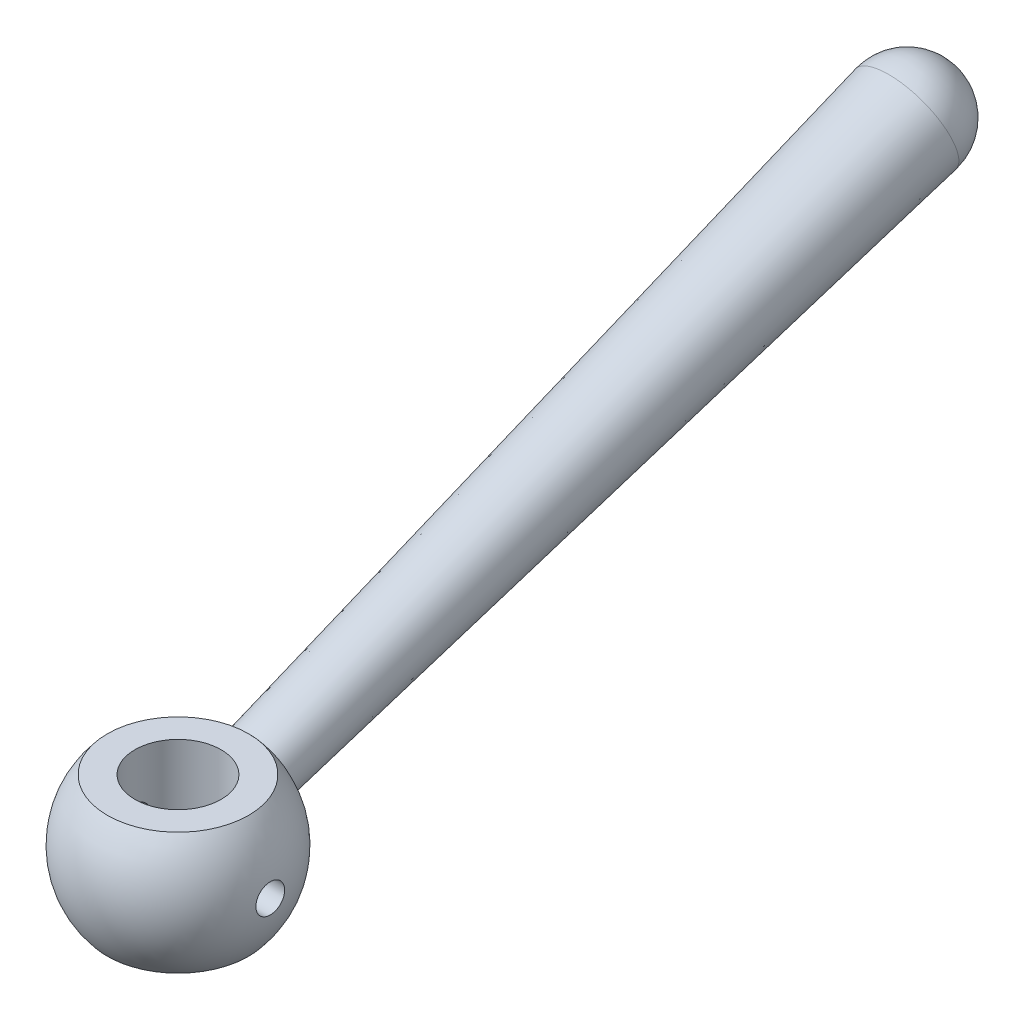
from build123d import *

# Parameters (mm, degrees)
CUT_EXTRUDE_1_DEPTH      = 23.516660498
CUT_EXTRUDE_1_DEPTH_BACK = 23.516660498
SKETCH_2_OUTSIDE_W       = 37.006
SKETCH_2_OUTSIDE_H       = 37.006
SKETCH_2_OUTSIDE_W_2     = 26
SKETCH_2_OUTSIDE_H_2     = 17
CUT_EXTRUDE_2_DEPTH      = 26.039968051
CUT_EXTRUDE_2_DEPTH_BACK = 26.039968051
SKETCH_3_R               = 6
CUT_EXTRUDE_3_DEPTH      = 21.254629101
CUT_EXTRUDE_3_DEPTH_BACK = 21.254629101
SKETCH_4_R               = 2


with BuildPart() as part:
    # 草图1 → 旋转1 (revolve)
    with BuildSketch(Plane(origin=(0, 0, 0), x_dir=(0, 0, -1), z_dir=(1, 0, 0))):
        with BuildLine():
            Line((0, 13), (0, -13))
            ThreePointArc((0, -13), (13, 0), (0, 13))
        make_face()
    revolve(axis=Axis((0, -13, 0), (0, -1, 0)))

    # 草图2 outside → 切除-拉伸1 (cut, two sides: drawn at the far end of the back side and taken through both)
    with BuildSketch(Plane(origin=(0, 0, 0), x_dir=(0, 0, -1), z_dir=(1, 0, 0)).offset(-CUT_EXTRUDE_1_DEPTH_BACK)):
        Rectangle(SKETCH_2_OUTSIDE_W, SKETCH_2_OUTSIDE_H)
        Rectangle(SKETCH_2_OUTSIDE_W_2, SKETCH_2_OUTSIDE_H_2, mode=Mode.SUBTRACT)
    extrude(amount=CUT_EXTRUDE_1_DEPTH + CUT_EXTRUDE_1_DEPTH_BACK, mode=Mode.SUBTRACT)

    # 草图3 → 切除-拉伸2 (cut, two sides: drawn at the far end of the back side and taken through both)
    with BuildSketch(Plane(origin=(0, 8.5, 0), x_dir=(1, 0, 0), z_dir=(0, 1, 0)).offset(-CUT_EXTRUDE_2_DEPTH_BACK)):
        with Locations(Location((0, 0, 0), (0, 0, 270))):
            Circle(SKETCH_3_R)
    extrude(amount=CUT_EXTRUDE_2_DEPTH + CUT_EXTRUDE_2_DEPTH_BACK, mode=Mode.SUBTRACT)

    # 草图4 → 切除-拉伸3 (cut, two sides: drawn at the far end of the back side and taken through both)
    with BuildSketch(Plane(origin=(0, 0, 0), x_dir=(0, 0, -1), z_dir=(1, 0, 0)).offset(-CUT_EXTRUDE_3_DEPTH_BACK)):
        Circle(SKETCH_4_R)
    extrude(amount=CUT_EXTRUDE_3_DEPTH + CUT_EXTRUDE_3_DEPTH_BACK, mode=Mode.SUBTRACT)

    # 草图5 → 旋转2 (revolve)
    with BuildSketch(Plane(origin=(0, 0, 0), x_dir=(0, 0, -1), z_dir=(1, 0, 0))):
        with BuildLine():
            Line((9.925994235, 8.394917417), (98.921294458, 43.451098455))
            ThreePointArc((98.921294458, 43.451098455), (104.361835013, 43.320509784), (108.06465139, 39.332316482))
            Line((108.06465139, 39.332316482), (11.462947931, 4.172171844))
            Line((11.462947931, 4.172171844), (9.925994235, 8.394917417))
        make_face()
    revolve(axis=Axis((0, 4.172171844, -11.462947931), (0, -0.34202014332566955, 0.9396926207859082)))


solid = part.part
